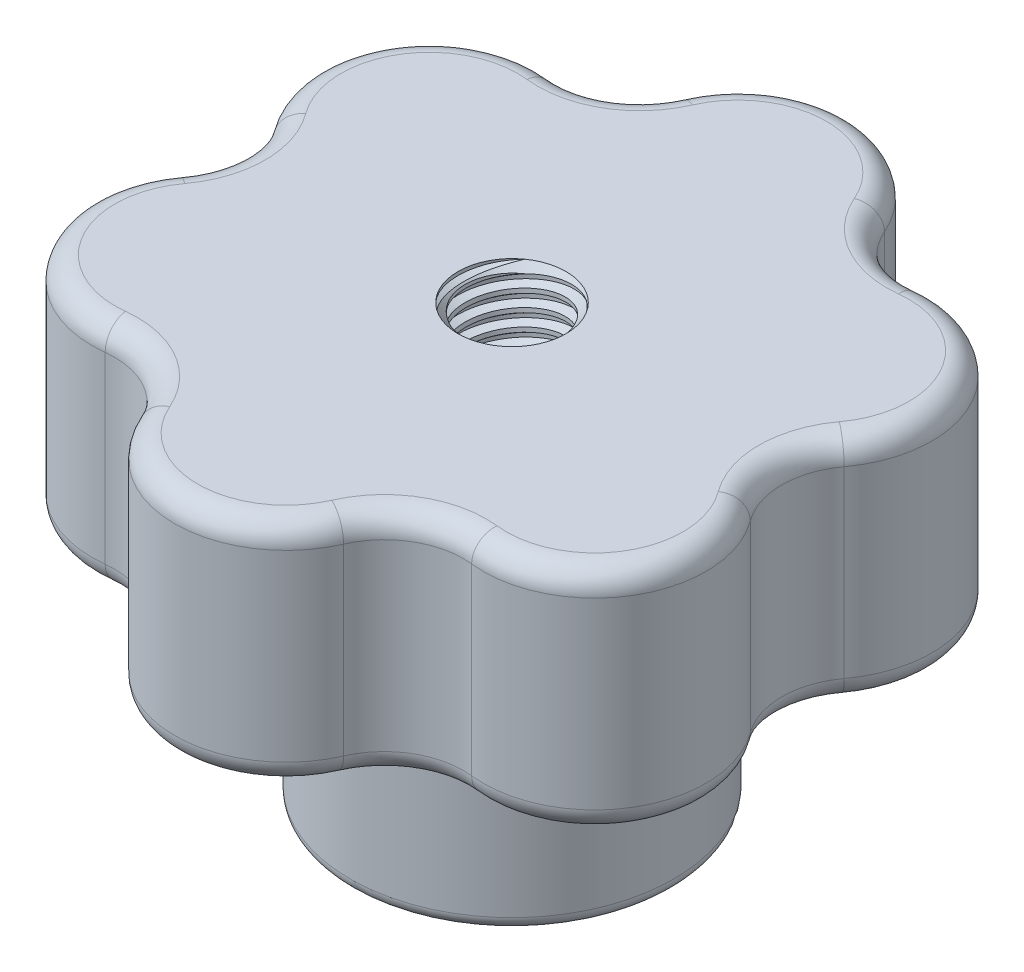
from build123d import *

# Parameters (mm, degrees)
CUT_EXTRUDE2_DEPTH  = 48.68647607
CIRPATTERN1_COUNT   = 6
SKETCH5_W           = 4
SKETCH5_H           = 32
LPATTERN1_COUNT     = 26
LPATTERN1_PITCH     = 1.25
LPATTERN1_COL_COUNT = 2
LPATTERN1_COL_PITCH = 1.25
FILLET1_R           = 1.7
FILLET2_R           = 1


with BuildPart() as part:
    # Sketch1 → Revolve1 (revolve)
    with BuildSketch(Plane.XY, mode=Mode.PRIVATE) as revolve1_sk:
        Polygon((0, 0), (12, 0), (12, 15), (25, 15), (25, 32), (0, 32), align=None)
    revolve(revolve1_sk.sketch.rotate(Axis((0, 0, 0), (0, -1, 0)), 180), axis=Axis((0, 0, 0), (0, -1, 0)))

    # Sketch11 → Cut-Extrude2 (cut, through all)
    with BuildSketch(Plane(origin=(0, 0, 0), x_dir=(1, 0, 0), z_dir=(0, 1, 0))):
        with BuildLine():
            Line((21.650635095, -12.5), (24.248711306, -14))
            ThreePointArc((24.248711306, -14), (28, 0), (24.248711306, 14))
            Line((24.248711306, 14), (21.650635095, 12.5))
            ThreePointArc((21.650635095, 12.5), (22.742944169, 7.912373072), (21.14380279, 3.475909752))
            ThreePointArc((21.14380279, 3.475909752), (20, 0), (21.14380279, -3.475909752))
            ThreePointArc((21.14380279, -3.475909752), (22.742944169, -7.912373072), (21.650635095, -12.5))
        make_face()
    cut_extrude2 = extrude(amount=CUT_EXTRUDE2_DEPTH, mode=Mode.SUBTRACT)

    # CirPattern1: Cut-Extrude2 ×6 about axis
    cirpattern1_axis = Axis((0, 0, 0), (0, 1, 0))
    for i in range(1, CIRPATTERN1_COUNT):
        add(cut_extrude2.rotate(cirpattern1_axis, i * 360 / CIRPATTERN1_COUNT), mode=Mode.SUBTRACT)

    # Sketch7 → Cut-Revolve2 (revolve, cut)
    with BuildSketch(Plane.XY, mode=Mode.PRIVATE) as cut_revolve2_sk:
        Polygon((0, 0), (4, 0), (3.415953356, 0.584046644), (3.415953356, 31.415953356), (4, 32), (0, 32), align=None)
    revolve(cut_revolve2_sk.sketch.rotate(Axis((0, 0, 0), (0, -1, 0)), 235.056269787), axis=Axis((0, 0, 0), (0, -1, 0)), mode=Mode.SUBTRACT)


with BuildPart() as body_2:
    # Sketch5 → Revolve2 (revolve)
    with BuildSketch(Plane.XY, mode=Mode.PRIVATE) as revolve2_sk:
        with Locations((2, 16)):
            Rectangle(SKETCH5_W, SKETCH5_H)
    revolve(revolve2_sk.sketch.rotate(Axis((0, 0, 0), (0, -1, 0)), 180), axis=Axis((0, 0, 0), (0, -1, 0)))

    # Sketch6 → Cut-Revolve1 (revolve, cut)
    with BuildSketch(Plane.XY, mode=Mode.PRIVATE) as cut_revolve1_sk:
        Polygon((4.024121388, 31.84562312), (4.1929711, 30.764984958), (3.464196131, 31.046478487), (3.415953356, 31.355232247), align=None)
    cut_revolve1 = revolve(cut_revolve1_sk.sketch.rotate(Axis((-0.208852549, 32, 0), (0.15437688027360985, -0.9880120337511015, 0)), 180), axis=Axis((-0.208852549, 32, 0), (0.15437688027360985, -0.9880120337511015, 0)), mode=Mode.SUBTRACT)

    # LPattern1: Cut-Revolve1 ×26
    with Locations(*[(0, -i * LPATTERN1_PITCH, 0) for i in range(1, LPATTERN1_COUNT)]):
        add(cut_revolve1, mode=Mode.SUBTRACT)

    # LPattern1 col: Cut-Revolve1 ×2
    with Locations(*[(0, i * LPATTERN1_COL_PITCH, 0) for i in range(1, LPATTERN1_COL_COUNT)]):
        add(cut_revolve1, mode=Mode.SUBTRACT)


with BuildPart() as part_1:
    add(part.part)

    # Combine1: cut body 2
    add(body_2.part, mode=Mode.SUBTRACT)

    # Fillet1
    fillet1_edges = [part_1.edges().sort_by_distance(p)[0] for p in [
        (21.650635095, 32, 12.5),
        (21.650635095, 32, -12.5),
        (20, 32, 0),
        (21.650635095, 15, -12.5),
        (20, 15, 0),
        (21.650635095, 15, 12.5),
        (0, 32, 25),
        (10, 32, 17.320508076),
        (0, 32, -25),
        (10, 32, -17.320508076),
        (-21.650635095, 32, -12.5),
        (-10, 32, -17.320508076),
        (-21.650635095, 32, 12.5),
        (-20, 32, 0),
        (-10, 32, 17.320508076),
        (0, 15, -25),
        (10, 15, -17.320508076),
        (-21.650635095, 15, -12.5),
        (-10, 15, -17.320508076),
        (-21.650635095, 15, 12.5),
        (-20, 15, 0),
        (0, 15, 25),
        (-10, 15, 17.320508076),
        (10, 15, 17.320508076),
    ]]
    fillet(fillet1_edges, radius=FILLET1_R)

    # Fillet2
    fillet2_edges = [part_1.edges().sort_by_distance(p)[0] for p in [
        (12, 0, 0),
    ]]
    fillet(fillet2_edges, radius=FILLET2_R)


solid = part_1.part
